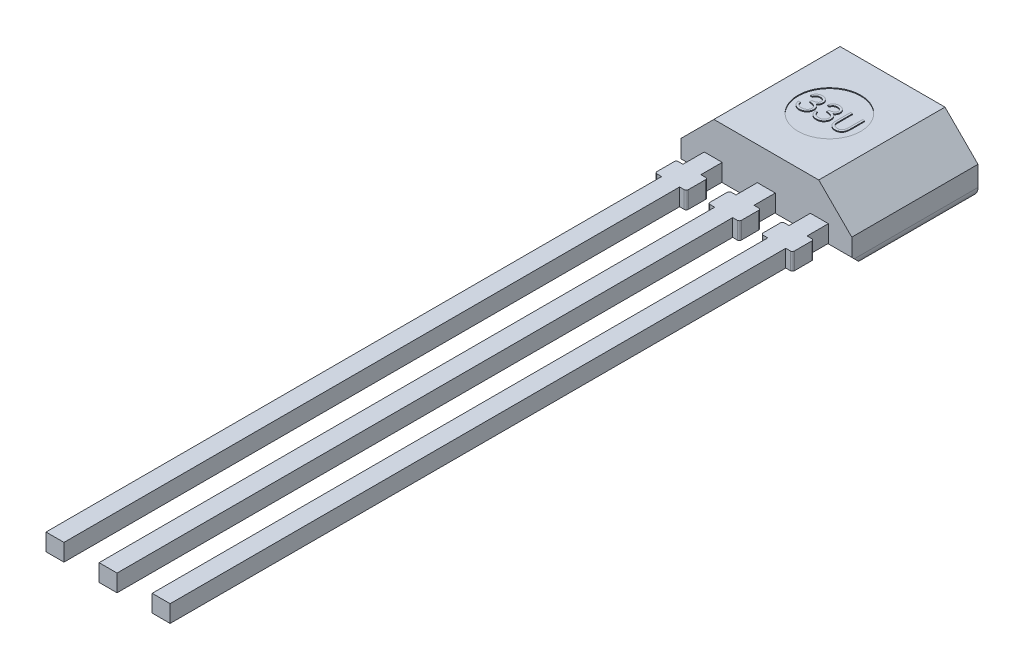
from build123d import *

# Parameters (mm, degrees)
SKETCH1_W                       = 4.09
SKETCH1_H                       = 1.52
BOSS_EXTRUDE1_DEPTH             = 1.51
CHAMFER1_SIZE                   = 0.79
CHAMFER2_SIZE                   = 0.31
SKETCH2_W                       = 0.43
SKETCH2_H                       = 0.41
BOSS_EXTRUDE2_DEPTH             = 15.75
LPATTERN1_COUNT                 = 3
LPATTERN1_PITCH                 = 1.27
SKETCH18_R                      = 0.75
CUT_EXTRUDE5_DEPTH              = 0.02
BOSS_EXTRUDE3_DEPTH             = 0.02
FILLET1_R                       = 0.25
SKETCH20_W                      = 0.75
SKETCH20_H                      = 0.51
DANBAR_REMOVAL_PROTRUSION_DEPTH = 0.41
FILLET2_R                       = 0.05
LPATTERN5_COUNT                 = 3
LPATTERN5_PITCH                 = 1.27
FILLET2_OF_LPATTERN5_R          = 0.05


with BuildPart() as part:
    # Sketch1 → Boss-Extrude1 (new, symmetric)
    with BuildSketch(Plane.XY):
        Rectangle(SKETCH1_W, SKETCH1_H)
    extrude(amount=BOSS_EXTRUDE1_DEPTH, both=True)

    # Chamfer1
    chamfer1_edges = [part.edges().sort_by_distance(p)[0] for p in [
        (-2.045, 0.76, 0),
        (2.045, 0.76, 0),
    ]]
    chamfer(chamfer1_edges, length=CHAMFER1_SIZE)

    # Chamfer2
    chamfer2_edges = [part.edges().sort_by_distance(p)[0] for p in [
        (0, -0.76, 1.51),
    ]]
    chamfer(chamfer2_edges, length=CHAMFER2_SIZE)

    # Sketch2 → Boss-Extrude2 (add)
    with BuildSketch(Plane.XY.offset(1.51)):
        with Locations((-1.27, -0.235)):
            Rectangle(SKETCH2_W, SKETCH2_H)
    boss_extrude2 = extrude(amount=BOSS_EXTRUDE2_DEPTH)

    # LPattern1: Boss-Extrude2 ×3
    with Locations(*[(i * LPATTERN1_PITCH, 0, 0) for i in range(1, LPATTERN1_COUNT)]):
        add(boss_extrude2)

    # Sketch18 → Cut-Extrude5 (cut)
    with BuildSketch(Plane(origin=(0, 0.76, 0), x_dir=(1, 0, 0), z_dir=(0, 1, 0))):
        with Locations(Location((0, 0, 0), (0, 0, 270))):
            Circle(SKETCH18_R)
    extrude(amount=-CUT_EXTRUDE5_DEPTH, mode=Mode.SUBTRACT)

    # Sketch19 → Boss-Extrude3 (add)
    with BuildSketch(Plane(origin=(0, 0.74, 0), x_dir=(1, 0, 0), z_dir=(0, 1, 0))):
        with BuildLine():
            Line((-0.556303419, 0.145266602), (-0.603792735, 0.145266602))
            add(Edge.make_bspline(
                [(-0.603792735, 0.145266602), (-0.602506172, 0.150593418), (-0.599991047, 0.161006908), (-0.594745104, 0.175885149), (-0.589030217, 0.189964538), (-0.582167816, 0.202981445), (-0.574682564, 0.215197469), (-0.566106629, 0.226335539), (-0.556835671, 0.236678928), (-0.546581184, 0.245858191), (-0.535827208, 0.2541703), (-0.524422212, 0.261257363), (-0.512595655, 0.267353991), (-0.500265598, 0.272376573), (-0.487395332, 0.276160194), (-0.47410121, 0.27890533), (-0.460348396, 0.280688034), (-0.451012748, 0.280862019), (-0.446272369, 0.280950363)],
                knots=[0, 0, 0, 0, 1.162005537, 2.271625781, 3.343758855, 4.383309926, 5.390229558, 6.379919256, 7.361854164, 8.333198761, 9.295911338, 10.242430842, 11.177959212, 12.116337295, 13.062827104, 14.020064771, 14.994644689, 16, 16, 16, 16], degree=3))
            add(Edge.make_bspline(
                [(-0.446272369, 0.280950363), (-0.439365574, 0.280741837), (-0.42570264, 0.280329332), (-0.405630132, 0.276562507), (-0.386273696, 0.270601802), (-0.367845202, 0.262365893), (-0.350727654, 0.252207812), (-0.335497302, 0.240117905), (-0.322360586, 0.226329439), (-0.311339651, 0.211099635), (-0.302710454, 0.194823147), (-0.296347395, 0.178071218), (-0.292473641, 0.160883587), (-0.291971605, 0.149278618), (-0.291720085, 0.143464552)],
                knots=[0, 0, 0, 0, 1.083050992, 2.142477498, 3.193116406, 4.255571735, 5.30263384, 6.308962982, 7.297363603, 8.282367274, 9.249857812, 10.179914175, 11.08814088, 12, 12, 12, 12], degree=3))
            add(Edge.make_bspline(
                [(-0.291720085, 0.143464552), (-0.291896009, 0.137869478), (-0.292240265, 0.126920784), (-0.295163337, 0.110936701), (-0.30008251, 0.09587184), (-0.306896629, 0.081662783), (-0.315717316, 0.068399623), (-0.326402355, 0.056052518), (-0.339027162, 0.044566705), (-0.348594335, 0.037986975), (-0.353519798, 0.034599535)],
                knots=[0, 0, 0, 0, 1.024540389, 2.004866551, 2.965041327, 3.920577974, 4.882998113, 5.874504559, 6.905732034, 8, 8, 8, 8], degree=3))
            add(Edge.make_bspline(
                [(-0.353519798, 0.034599535), (-0.347890712, 0.031881407), (-0.336737863, 0.026496008), (-0.32153558, 0.015934483), (-0.307735235, 0.003740012), (-0.300039077, -0.005776318), (-0.296172209, -0.010557716)],
                knots=[0, 0, 0, 0, 1.015518401, 2.012035669, 3.001164323, 4, 4, 4, 4], degree=3))
            add(Edge.make_bspline(
                [(-0.296172209, -0.010557716), (-0.293625958, -0.014043829), (-0.288575154, -0.020958966), (-0.282340734, -0.032076974), (-0.276684832, -0.043318211), (-0.272277596, -0.054983978), (-0.268864643, -0.066939065), (-0.266425028, -0.079203998), (-0.264909474, -0.091788795), (-0.264692432, -0.100302705), (-0.264583333, -0.104582323)],
                knots=[0, 0, 0, 0, 1.025084078, 2.033381695, 3.024893161, 4.013698104, 4.991890475, 5.976764909, 6.982997093, 8, 8, 8, 8], degree=3))
            add(Edge.make_bspline(
                [(-0.264583333, -0.104582323), (-0.264854647, -0.111992126), (-0.265395997, -0.126776861), (-0.270234708, -0.148620063), (-0.277735757, -0.169972014), (-0.288388175, -0.190394043), (-0.301370525, -0.209501553), (-0.316815739, -0.226597614), (-0.334548327, -0.241293118), (-0.354324895, -0.253571331), (-0.375751175, -0.263386302), (-0.398667961, -0.270198558), (-0.422745053, -0.274635394), (-0.439256156, -0.275111171), (-0.447650407, -0.275353056)],
                knots=[0, 0, 0, 0, 0.955779014, 1.907060117, 2.875433937, 3.871313158, 4.872415639, 5.851225146, 6.836215519, 7.83643374, 8.849228613, 9.86973379, 10.916971861, 12, 12, 12, 12], degree=3))
            add(Edge.make_bspline(
                [(-0.447650407, -0.275353056), (-0.453307849, -0.27522179), (-0.464439808, -0.274963503), (-0.480805194, -0.27319781), (-0.496426451, -0.269972916), (-0.5113247, -0.26563325), (-0.525513176, -0.260131165), (-0.538948582, -0.25327941), (-0.551713578, -0.245219218), (-0.563687705, -0.23585545), (-0.574869536, -0.225380771), (-0.584961912, -0.21360923), (-0.594133095, -0.200758432), (-0.602137518, -0.186679113), (-0.609339771, -0.171553223), (-0.615263559, -0.155187081), (-0.620477448, -0.137726996), (-0.622901556, -0.125559529), (-0.624145299, -0.119316731)],
                knots=[0, 0, 0, 0, 1.048658725, 2.063410685, 3.046034179, 4.001477787, 4.936774919, 5.862367409, 6.792675028, 7.730719943, 8.675894397, 9.627829632, 10.600096036, 11.597688215, 12.626045268, 13.701542398, 14.82072376, 16, 16, 16, 16], degree=3))
            Line((-0.624145299, -0.119316731), (-0.576655983, -0.119316731))
            add(Edge.make_bspline(
                [(-0.576655983, -0.119316731), (-0.575418747, -0.123391165), (-0.573012216, -0.131316293), (-0.568915816, -0.142722149), (-0.564248828, -0.153178188), (-0.559242222, -0.162761113), (-0.553984052, -0.171565297), (-0.548100486, -0.179357937), (-0.542027294, -0.186481307), (-0.537449344, -0.190494599), (-0.535208834, -0.192458758)],
                knots=[0, 0, 0, 0, 1.198163088, 2.33053128, 3.407730985, 4.417276592, 5.372219308, 6.28897303, 7.162600585, 8, 8, 8, 8], degree=3))
            add(Edge.make_bspline(
                [(-0.535208834, -0.192458758), (-0.532246018, -0.194742994), (-0.526329532, -0.199304416), (-0.516688383, -0.205125495), (-0.506548811, -0.210169365), (-0.495691116, -0.214022257), (-0.484349598, -0.217284594), (-0.472340936, -0.219419482), (-0.459771079, -0.220884241), (-0.451188333, -0.221013498), (-0.446802384, -0.221079551)],
                knots=[0, 0, 0, 0, 0.946170439, 1.889420265, 2.845303464, 3.807233317, 4.801018734, 5.828864929, 6.890507805, 8, 8, 8, 8], degree=3))
            add(Edge.make_bspline(
                [(-0.446802384, -0.221079551), (-0.441850366, -0.220986432), (-0.432167123, -0.220804346), (-0.418037638, -0.219129805), (-0.404595679, -0.21669104), (-0.391990487, -0.212924434), (-0.380056946, -0.208270663), (-0.368962339, -0.202427392), (-0.358561023, -0.195571702), (-0.34898622, -0.187779472), (-0.340376602, -0.179249079), (-0.332795985, -0.170326865), (-0.326351542, -0.161050448), (-0.321153072, -0.151368494), (-0.317048168, -0.141321096), (-0.314253684, -0.130880059), (-0.312310657, -0.120130829), (-0.312152419, -0.112823949), (-0.31207265, -0.109140449)],
                knots=[0, 0, 0, 0, 1.217147791, 2.380027433, 3.494444702, 4.572153297, 5.609568379, 6.639424714, 7.649109417, 8.668170816, 9.669597737, 10.625200337, 11.543417969, 12.441394052, 13.322311151, 14.205496177, 15.095365482, 16, 16, 16, 16], degree=3))
            add(Edge.make_bspline(
                [(-0.31207265, -0.109140449), (-0.312304017, -0.104209925), (-0.312765599, -0.094373411), (-0.316289635, -0.079901825), (-0.322086106, -0.065958524), (-0.330200878, -0.052781398), (-0.340079018, -0.040568851), (-0.351624665, -0.029672329), (-0.364933695, -0.020681018), (-0.377183127, -0.014468805), (-0.388033335, -0.010229866), (-0.397318757, -0.007406389), (-0.4077141, -0.005015515), (-0.419093655, -0.00279116), (-0.431543165, -0.000898051), (-0.445049077, 0.000680652), (-0.459614127, 0.001943855), (-0.469697196, 0.002507961), (-0.474893162, 0.002798654)],
                knots=[0, 0, 0, 0, 1.07054697, 2.135767047, 3.216561865, 4.33974944, 5.486079747, 6.621378074, 7.775625952, 8.963672916, 9.598146892, 10.304877434, 11.070270905, 11.915000392, 12.823868403, 13.805723172, 14.86925407, 16, 16, 16, 16], degree=3))
            Line((-0.474893162, 0.002798654), (-0.474893162, 0.057072158))
            add(Edge.make_bspline(
                [(-0.474893162, 0.057072158), (-0.468346439, 0.057183253), (-0.455523015, 0.057400862), (-0.436791376, 0.060032787), (-0.418879339, 0.063673549), (-0.402183868, 0.069250239), (-0.386966741, 0.075727283), (-0.373764848, 0.083264463), (-0.362763149, 0.091642645), (-0.354015106, 0.100991147), (-0.347433901, 0.11101735), (-0.342621992, 0.121467131), (-0.339779562, 0.132432078), (-0.339400124, 0.1399152), (-0.339209402, 0.143676558)],
                knots=[0, 0, 0, 0, 1.321986639, 2.589447074, 3.816329219, 5.01088745, 6.139805852, 7.153945165, 8.075214402, 8.924034688, 9.728124013, 10.488707548, 11.240355623, 12, 12, 12, 12], degree=3))
            add(Edge.make_bspline(
                [(-0.339209402, 0.143676558), (-0.339272057, 0.146439979), (-0.339396706, 0.151937674), (-0.340968675, 0.159969679), (-0.343330881, 0.167756131), (-0.346578412, 0.175263919), (-0.350925168, 0.182440973), (-0.356127026, 0.18934848), (-0.362321012, 0.195947003), (-0.369418717, 0.20209748), (-0.377040502, 0.20795902), (-0.385393741, 0.212935248), (-0.394226572, 0.217190514), (-0.403548774, 0.220699569), (-0.413390598, 0.223339247), (-0.423705804, 0.225234547), (-0.434514061, 0.226419526), (-0.441887882, 0.226590132), (-0.445636351, 0.226676859)],
                knots=[0, 0, 0, 0, 0.884392785, 1.759457502, 2.611959086, 3.489218968, 4.37281399, 5.2945488, 6.255912374, 7.266815255, 8.301784654, 9.332968512, 10.37626691, 11.440494194, 12.520033166, 13.637162961, 14.798855837, 16, 16, 16, 16], degree=3))
            add(Edge.make_bspline(
                [(-0.445636351, 0.226676859), (-0.451661544, 0.226466498), (-0.463430147, 0.226055615), (-0.480395974, 0.222456826), (-0.496168063, 0.216714901), (-0.50822379, 0.209860981), (-0.517126275, 0.203095141), (-0.523487907, 0.197186257), (-0.529735175, 0.190619627), (-0.535457081, 0.182990801), (-0.541243741, 0.174816418), (-0.546511907, 0.165680933), (-0.55163117, 0.155822649), (-0.554715841, 0.148853428), (-0.556303419, 0.145266602)],
                knots=[0, 0, 0, 0, 1.472543308, 2.876219568, 4.221790263, 5.565193594, 6.249813518, 6.953379497, 7.687249741, 8.463570142, 9.283606569, 10.136032583, 11.040678096, 12, 12, 12, 12], degree=3))
        make_face()
        with BuildLine():
            Line((-0.149252137, 0.145266602), (-0.196741453, 0.145266602))
            add(Edge.make_bspline(
                [(-0.196741453, 0.145266602), (-0.19545489, 0.150593418), (-0.192939765, 0.161006908), (-0.187693822, 0.175885149), (-0.181978934, 0.189964538), (-0.175116534, 0.202981445), (-0.167631282, 0.215197469), (-0.159055347, 0.226335539), (-0.149784389, 0.236678928), (-0.139529902, 0.245858191), (-0.128775926, 0.2541703), (-0.11737093, 0.261257363), (-0.105544373, 0.267353991), (-0.093214316, 0.272376573), (-0.08034405, 0.276160194), (-0.067049928, 0.27890533), (-0.053297113, 0.280688034), (-0.043961466, 0.280862019), (-0.039221087, 0.280950363)],
                knots=[0, 0, 0, 0, 1.162005537, 2.271625781, 3.343758855, 4.383309926, 5.390229558, 6.379919256, 7.361854164, 8.333198761, 9.295911338, 10.242430842, 11.177959212, 12.116337295, 13.062827104, 14.020064771, 14.994644689, 16, 16, 16, 16], degree=3))
            add(Edge.make_bspline(
                [(-0.039221087, 0.280950363), (-0.032314292, 0.280741837), (-0.018651358, 0.280329332), (0.001421151, 0.276562507), (0.020777586, 0.270601802), (0.03920608, 0.262365893), (0.056323628, 0.252207812), (0.07155398, 0.240117905), (0.084690696, 0.226329439), (0.095711631, 0.211099635), (0.104340828, 0.194823147), (0.110703887, 0.178071218), (0.114577641, 0.160883587), (0.115079677, 0.149278618), (0.115331197, 0.143464552)],
                knots=[0, 0, 0, 0, 1.083050992, 2.142477498, 3.193116406, 4.255571735, 5.30263384, 6.308962982, 7.297363603, 8.282367274, 9.249857812, 10.179914175, 11.08814088, 12, 12, 12, 12], degree=3))
            add(Edge.make_bspline(
                [(0.115331197, 0.143464552), (0.115155273, 0.137869478), (0.114811017, 0.126920784), (0.111887945, 0.110936701), (0.106968772, 0.09587184), (0.100154653, 0.081662783), (0.091333966, 0.068399623), (0.080648927, 0.056052518), (0.06802412, 0.044566705), (0.058456947, 0.037986975), (0.053531484, 0.034599535)],
                knots=[0, 0, 0, 0, 1.024540389, 2.004866551, 2.965041327, 3.920577974, 4.882998113, 5.874504559, 6.905732034, 8, 8, 8, 8], degree=3))
            add(Edge.make_bspline(
                [(0.053531484, 0.034599535), (0.05916057, 0.031881407), (0.070313419, 0.026496008), (0.085515702, 0.015934483), (0.099316047, 0.003740012), (0.107012205, -0.005776318), (0.110879073, -0.010557716)],
                knots=[0, 0, 0, 0, 1.015518401, 2.012035669, 3.001164323, 4, 4, 4, 4], degree=3))
            add(Edge.make_bspline(
                [(0.110879073, -0.010557716), (0.113425324, -0.014043829), (0.118476128, -0.020958966), (0.124710548, -0.032076974), (0.13036645, -0.043318211), (0.134773686, -0.054983978), (0.138186639, -0.066939065), (0.140626254, -0.079203998), (0.142141808, -0.091788795), (0.14235885, -0.100302705), (0.142467949, -0.104582323)],
                knots=[0, 0, 0, 0, 1.025084078, 2.033381695, 3.024893161, 4.013698104, 4.991890475, 5.976764909, 6.982997093, 8, 8, 8, 8], degree=3))
            add(Edge.make_bspline(
                [(0.142467949, -0.104582323), (0.142196635, -0.111992126), (0.141655285, -0.126776861), (0.136816574, -0.148620063), (0.129315525, -0.169972014), (0.118663107, -0.190394043), (0.105680757, -0.209501553), (0.090235543, -0.226597614), (0.072502955, -0.241293118), (0.052726387, -0.253571331), (0.031300107, -0.263386302), (0.008383321, -0.270198558), (-0.015693771, -0.274635394), (-0.032204874, -0.275111171), (-0.040599125, -0.275353056)],
                knots=[0, 0, 0, 0, 0.955779014, 1.907060117, 2.875433937, 3.871313158, 4.872415639, 5.851225146, 6.836215519, 7.83643374, 8.849228613, 9.86973379, 10.916971861, 12, 12, 12, 12], degree=3))
            add(Edge.make_bspline(
                [(-0.040599125, -0.275353056), (-0.046256567, -0.27522179), (-0.057388526, -0.274963503), (-0.073753912, -0.27319781), (-0.089375169, -0.269972916), (-0.104273418, -0.26563325), (-0.118461894, -0.260131165), (-0.1318973, -0.25327941), (-0.144662296, -0.245219218), (-0.156636423, -0.23585545), (-0.167818254, -0.225380771), (-0.17791063, -0.21360923), (-0.187081813, -0.200758432), (-0.195086236, -0.186679113), (-0.202288489, -0.171553223), (-0.208212277, -0.155187081), (-0.213426166, -0.137726996), (-0.215850274, -0.125559529), (-0.217094017, -0.119316731)],
                knots=[0, 0, 0, 0, 1.048658725, 2.063410685, 3.046034179, 4.001477787, 4.936774919, 5.862367409, 6.792675028, 7.730719943, 8.675894397, 9.627829632, 10.600096036, 11.597688215, 12.626045268, 13.701542398, 14.82072376, 16, 16, 16, 16], degree=3))
            Line((-0.217094017, -0.119316731), (-0.169604701, -0.119316731))
            add(Edge.make_bspline(
                [(-0.169604701, -0.119316731), (-0.168367465, -0.123391165), (-0.165960934, -0.131316293), (-0.161864534, -0.142722149), (-0.157197546, -0.153178188), (-0.15219094, -0.162761113), (-0.14693277, -0.171565297), (-0.141049204, -0.179357937), (-0.134976012, -0.186481307), (-0.130398062, -0.190494599), (-0.128157552, -0.192458758)],
                knots=[0, 0, 0, 0, 1.198163088, 2.33053128, 3.407730985, 4.417276592, 5.372219308, 6.28897303, 7.162600585, 8, 8, 8, 8], degree=3))
            add(Edge.make_bspline(
                [(-0.128157552, -0.192458758), (-0.125194736, -0.194742994), (-0.11927825, -0.199304416), (-0.109637101, -0.205125495), (-0.099497529, -0.210169365), (-0.088639834, -0.214022257), (-0.077298315, -0.217284594), (-0.065289654, -0.219419482), (-0.052719796, -0.220884241), (-0.044137051, -0.221013498), (-0.039751102, -0.221079551)],
                knots=[0, 0, 0, 0, 0.946170439, 1.889420265, 2.845303464, 3.807233317, 4.801018734, 5.828864929, 6.890507805, 8, 8, 8, 8], degree=3))
            add(Edge.make_bspline(
                [(-0.039751102, -0.221079551), (-0.034799084, -0.220986432), (-0.025115841, -0.220804346), (-0.010986356, -0.219129805), (0.002455603, -0.21669104), (0.015060795, -0.212924434), (0.026994336, -0.208270663), (0.038088943, -0.202427392), (0.048490259, -0.195571702), (0.058065062, -0.187779472), (0.06667468, -0.179249079), (0.074255297, -0.170326865), (0.08069974, -0.161050448), (0.08589821, -0.151368494), (0.090003114, -0.141321096), (0.092797598, -0.130880059), (0.094740625, -0.120130829), (0.094898863, -0.112823949), (0.094978632, -0.109140449)],
                knots=[0, 0, 0, 0, 1.217147791, 2.380027433, 3.494444702, 4.572153297, 5.609568379, 6.639424714, 7.649109417, 8.668170816, 9.669597737, 10.625200337, 11.543417969, 12.441394052, 13.322311151, 14.205496177, 15.095365482, 16, 16, 16, 16], degree=3))
            add(Edge.make_bspline(
                [(0.094978632, -0.109140449), (0.094747265, -0.104209925), (0.094285683, -0.094373411), (0.090761647, -0.079901825), (0.084965176, -0.065958524), (0.076850404, -0.052781398), (0.066972264, -0.040568851), (0.055426617, -0.029672329), (0.042117587, -0.020681018), (0.029868155, -0.014468805), (0.019017947, -0.010229866), (0.009732525, -0.007406389), (-0.000662818, -0.005015515), (-0.012042373, -0.00279116), (-0.024491883, -0.000898051), (-0.037997795, 0.000680652), (-0.052562845, 0.001943855), (-0.062645914, 0.002507961), (-0.06784188, 0.002798654)],
                knots=[0, 0, 0, 0, 1.07054697, 2.135767047, 3.216561865, 4.33974944, 5.486079747, 6.621378074, 7.775625952, 8.963672916, 9.598146892, 10.304877434, 11.070270905, 11.915000392, 12.823868403, 13.805723172, 14.86925407, 16, 16, 16, 16], degree=3))
            Line((-0.06784188, 0.002798654), (-0.06784188, 0.057072158))
            add(Edge.make_bspline(
                [(-0.06784188, 0.057072158), (-0.061295156, 0.057183253), (-0.048471733, 0.057400862), (-0.029740094, 0.060032787), (-0.011828057, 0.063673549), (0.004867414, 0.069250239), (0.020084541, 0.075727283), (0.033286434, 0.083264463), (0.044288133, 0.091642645), (0.053036176, 0.100991147), (0.059617381, 0.11101735), (0.06442929, 0.121467131), (0.06727172, 0.132432078), (0.067651158, 0.1399152), (0.06784188, 0.143676558)],
                knots=[0, 0, 0, 0, 1.321986639, 2.589447074, 3.816329219, 5.01088745, 6.139805852, 7.153945165, 8.075214402, 8.924034688, 9.728124013, 10.488707548, 11.240355623, 12, 12, 12, 12], degree=3))
            add(Edge.make_bspline(
                [(0.06784188, 0.143676558), (0.067779225, 0.146439979), (0.067654576, 0.151937674), (0.066082607, 0.159969679), (0.063720401, 0.167756131), (0.06047287, 0.175263919), (0.056126114, 0.182440973), (0.050924256, 0.18934848), (0.04473027, 0.195947003), (0.037632565, 0.20209748), (0.030010781, 0.20795902), (0.021657541, 0.212935248), (0.01282471, 0.217190514), (0.003502508, 0.220699569), (-0.006339316, 0.223339247), (-0.016654522, 0.225234547), (-0.027462779, 0.226419526), (-0.0348366, 0.226590132), (-0.038585069, 0.226676859)],
                knots=[0, 0, 0, 0, 0.884392785, 1.759457502, 2.611959086, 3.489218968, 4.37281399, 5.2945488, 6.255912374, 7.266815255, 8.301784654, 9.332968512, 10.37626691, 11.440494194, 12.520033166, 13.637162961, 14.798855837, 16, 16, 16, 16], degree=3))
            add(Edge.make_bspline(
                [(-0.038585069, 0.226676859), (-0.044610262, 0.226466498), (-0.056378865, 0.226055615), (-0.073344691, 0.222456826), (-0.089116781, 0.216714901), (-0.101172508, 0.209860981), (-0.110074993, 0.203095141), (-0.116436625, 0.197186257), (-0.122683893, 0.190619627), (-0.128405799, 0.182990801), (-0.134192459, 0.174816418), (-0.139460625, 0.165680933), (-0.144579888, 0.155822649), (-0.147664559, 0.148853428), (-0.149252137, 0.145266602)],
                knots=[0, 0, 0, 0, 1.472543308, 2.876219568, 4.221790263, 5.565193594, 6.249813518, 6.953379497, 7.687249741, 8.463570142, 9.283606569, 10.136032583, 11.040678096, 12, 12, 12, 12], degree=3))
        make_face()
        with BuildLine():
            Line((0.237446581, 0.267381987), (0.284935897, 0.267381987))
            Line((0.284935897, 0.267381987), (0.284935897, -0.049672801))
            add(Edge.make_bspline(
                [(0.284935897, -0.049672801), (0.28492883, -0.054160245), (0.284915419, -0.062675945), (0.285005001, -0.074796628), (0.285255882, -0.085572345), (0.285414051, -0.095044632), (0.285765922, -0.103170024), (0.286052889, -0.109992541), (0.286421878, -0.115479879), (0.286865337, -0.118682233), (0.287055956, -0.120058751)],
                knots=[0, 0, 0, 0, 1.528628734, 2.90083645, 4.128790002, 5.200304208, 6.127813768, 6.898992206, 7.526736466, 8, 8, 8, 8], degree=3))
            add(Edge.make_bspline(
                [(0.287055956, -0.120058751), (0.287838739, -0.125024869), (0.289360197, -0.134677282), (0.293237685, -0.148421748), (0.29865295, -0.160809005), (0.305069934, -0.172225593), (0.313526412, -0.182353746), (0.323656708, -0.19168396), (0.335930014, -0.199843983), (0.349576558, -0.207305356), (0.364285159, -0.213302338), (0.379315196, -0.217837049), (0.394440741, -0.220600645), (0.4045669, -0.220920645), (0.409595353, -0.221079551)],
                knots=[0, 0, 0, 0, 1.035780045, 2.013197591, 2.933192213, 3.817615948, 4.702609284, 5.640816605, 6.646850145, 7.73207398, 8.84249596, 9.914020372, 10.964143139, 12, 12, 12, 12], degree=3))
            add(Edge.make_bspline(
                [(0.409595353, -0.221079551), (0.413912406, -0.220917195), (0.422521579, -0.220593421), (0.435313266, -0.218588419), (0.447771377, -0.214974881), (0.459957433, -0.210312204), (0.471380022, -0.204151556), (0.482045519, -0.197034893), (0.491565066, -0.188687535), (0.500252168, -0.179449744), (0.507816974, -0.169026703), (0.514374277, -0.157645366), (0.519745459, -0.145134453), (0.522397873, -0.136342058), (0.523760517, -0.131825078)],
                knots=[0, 0, 0, 0, 0.994687771, 1.983630487, 2.973142513, 3.978332533, 4.983357753, 5.956394766, 6.925816176, 7.893390482, 8.871859704, 9.88551698, 10.913711441, 12, 12, 12, 12], degree=3))
            add(Edge.make_bspline(
                [(0.523760517, -0.131825078), (0.524214107, -0.129958091), (0.525224889, -0.125797692), (0.526169383, -0.118764116), (0.527153108, -0.110465367), (0.527835668, -0.100841819), (0.52850109, -0.089925719), (0.528899186, -0.077660202), (0.52908319, -0.064089804), (0.529138023, -0.054619662), (0.529166667, -0.049672801)],
                knots=[0, 0, 0, 0, 0.558680831, 1.244966039, 2.062412453, 2.990489873, 4.051219941, 5.244515665, 6.560634259, 8, 8, 8, 8], degree=3))
            Line((0.529166667, -0.049672801), (0.529166667, 0.267381987))
            Line((0.529166667, 0.267381987), (0.576655983, 0.267381987))
            Line((0.576655983, 0.267381987), (0.576655983, -0.052216871))
            add(Edge.make_bspline(
                [(0.576655983, -0.052216871), (0.576617562, -0.057976983), (0.576542582, -0.069218192), (0.575892376, -0.0856906), (0.574855663, -0.101316586), (0.573390916, -0.116098252), (0.571450084, -0.129982702), (0.569291806, -0.143091637), (0.566543234, -0.155330959), (0.563332946, -0.166796098), (0.559663017, -0.17770986), (0.554909415, -0.18806771), (0.549553568, -0.19818453), (0.543201352, -0.207907304), (0.536063441, -0.21727908), (0.527982056, -0.226243024), (0.519224474, -0.23494238), (0.509645112, -0.243153998), (0.499401878, -0.250684596), (0.488525242, -0.257306402), (0.477098754, -0.26290402), (0.465152117, -0.267511689), (0.452680233, -0.270976159), (0.439682787, -0.27355776), (0.426130194, -0.275024655), (0.416912919, -0.275242661), (0.412245426, -0.275353056)],
                knots=[0, 0, 0, 0, 1.316592851, 2.569410997, 3.76748051, 4.895814652, 5.963796859, 6.97159953, 7.931736103, 8.829262218, 9.692595152, 10.560224239, 11.431080259, 12.30701507, 13.211635791, 14.121146779, 15.063487852, 16.031507147, 17.00238618, 17.966455255, 18.938106653, 19.907068911, 20.888905087, 21.893141452, 22.933117798, 24, 24, 24, 24], degree=3))
            add(Edge.make_bspline(
                [(0.412245426, -0.275353056), (0.407154978, -0.275234407), (0.397167538, -0.275001618), (0.38245095, -0.273667702), (0.368342732, -0.271155159), (0.354693879, -0.267955977), (0.341690213, -0.263543674), (0.329157514, -0.258388362), (0.317310428, -0.252056919), (0.305956759, -0.245012442), (0.295399921, -0.237086336), (0.285709004, -0.228447286), (0.27686801, -0.219233681), (0.269025957, -0.209345769), (0.262052918, -0.198860451), (0.256046088, -0.187748066), (0.250888491, -0.176012916), (0.248226545, -0.167855706), (0.246880843, -0.163731962)],
                knots=[0, 0, 0, 0, 1.13879206, 2.234305948, 3.301075583, 4.341971843, 5.366689343, 6.369221514, 7.369726634, 8.367512178, 9.355451585, 10.318319045, 11.268648973, 12.207971039, 13.137398894, 14.081662264, 15.030215811, 16, 16, 16, 16], degree=3))
            add(Edge.make_bspline(
                [(0.246880843, -0.163731962), (0.246098106, -0.160914894), (0.244400332, -0.154804611), (0.242582221, -0.144692011), (0.241053824, -0.133048089), (0.239616674, -0.119872048), (0.238768653, -0.105153675), (0.238025184, -0.088899351), (0.237441344, -0.071089421), (0.237444787, -0.05868356), (0.237446581, -0.052216871)],
                knots=[0, 0, 0, 0, 0.625038921, 1.35572334, 2.194682327, 3.136881307, 4.189498639, 5.346923369, 6.617055217, 8, 8, 8, 8], degree=3))
            Line((0.237446581, -0.052216871), (0.237446581, 0.267381987))
        make_face()
    extrude(amount=BOSS_EXTRUDE3_DEPTH)

    # Fillet1
    fillet1_edges = [part.edges().sort_by_distance(p)[0] for p in [
        (2.045, -0.76, -0.155),
        (-2.045, -0.76, -0.155),
    ]]
    fillet(fillet1_edges, radius=FILLET1_R)

    # Sketch20 → DANBAR REMOVAL PROTRUSION (add)
    with BuildSketch(Plane(origin=(0, -0.03, 0), x_dir=(1, 0, 0), z_dir=(0, 1, 0))):
        with Locations((-1.27, -2.275)):
            Rectangle(SKETCH20_W, SKETCH20_H)
    danbar_removal_protrusion = extrude(amount=-DANBAR_REMOVAL_PROTRUSION_DEPTH)

    # Fillet2
    fillet2_edges = [part.edges().sort_by_distance(p)[0] for p in [
        (-0.895, -0.235, 2.53),
        (-1.645, -0.235, 2.02),
        (-0.895, -0.235, 2.02),
        (-1.645, -0.235, 2.53),
    ]]
    fillet(fillet2_edges, radius=FILLET2_R)

    # LPattern5: DANBAR REMOVAL PROTRUSION ×3
    with Locations(*[(i * LPATTERN5_PITCH, 0, 0) for i in range(1, LPATTERN5_COUNT)]):
        add(danbar_removal_protrusion)

    # Fillet2 of LPattern5
    fillet2_of_lpattern5_edges = [part.edges().sort_by_distance(p)[0] for p in [
        (0.375, -0.235, 2.53),
        (-0.375, -0.235, 2.02),
        (0.375, -0.235, 2.02),
        (-0.375, -0.235, 2.53),
        (1.645, -0.235, 2.53),
        (0.895, -0.235, 2.02),
        (1.645, -0.235, 2.02),
        (0.895, -0.235, 2.53),
    ]]
    fillet(fillet2_of_lpattern5_edges, radius=FILLET2_OF_LPATTERN5_R)


solid = part.part
